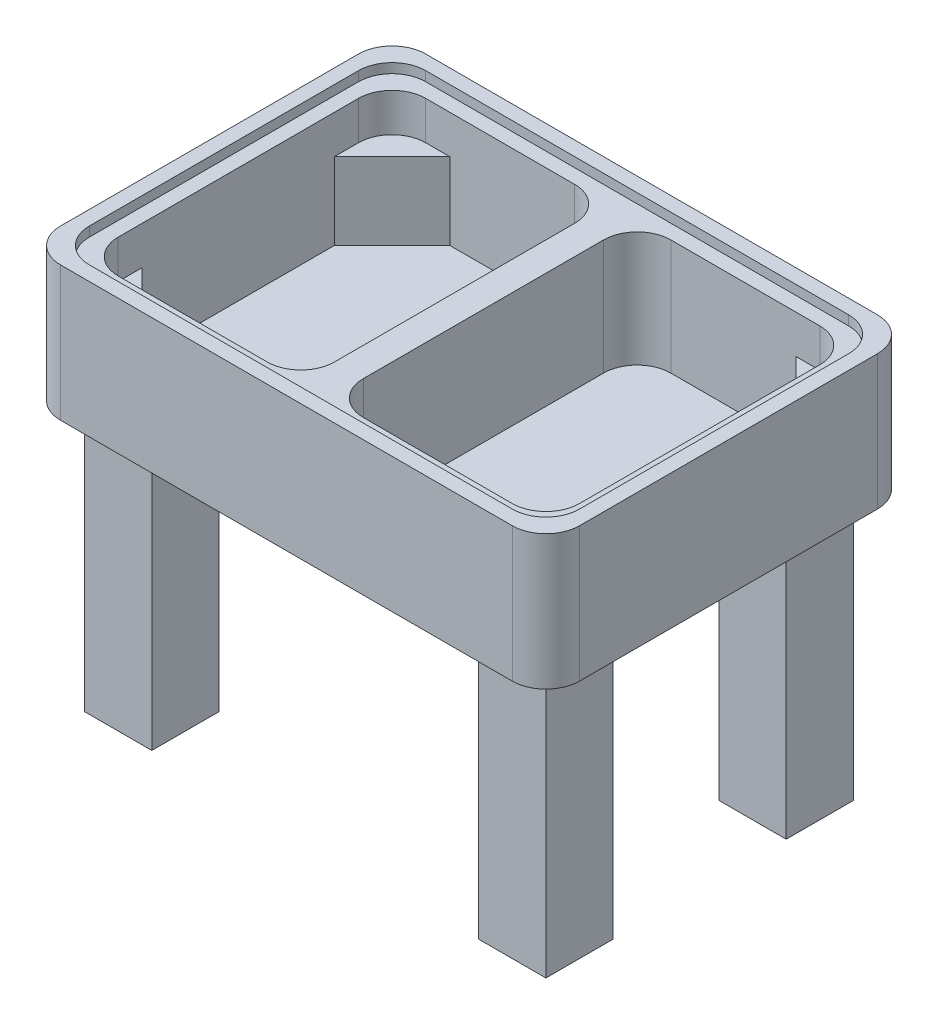
from build123d import *

# Parameters (mm, degrees)
SKETCH1_W           = 540
SKETCH1_H           = 380
BOSS_EXTRUDE1_DEPTH = 140
SKETCH3_W           = 510
SKETCH3_H           = 350
CUT_EXTRUDE1_DEPTH  = 10
SKETCH2_W           = 225
SKETCH2_H           = 320
CUT_EXTRUDE2_DEPTH  = 40
CUT_EXTRUDE3_DEPTH  = 80
FILLET1_R           = 35
SKETCH6_W           = 70
SKETCH6_H           = 70
BOSS_EXTRUDE2_DEPTH = 280


with BuildPart() as part:
    # Sketch1 → Boss-Extrude1 (new body)
    with BuildSketch(Plane(origin=(0, 0, 0), x_dir=(1, 0, 0), z_dir=(0, 1, 0))):
        with Locations((270, 190)):
            Rectangle(SKETCH1_W, SKETCH1_H)
    extrude(amount=-BOSS_EXTRUDE1_DEPTH)

    # Sketch3 → Cut-Extrude1 (cut)
    with BuildSketch(Plane(origin=(0, 0, 0), x_dir=(1, 0, 0), z_dir=(0, 1, 0))):
        with Locations((270, 190)):
            Rectangle(SKETCH3_W, SKETCH3_H)
    extrude(amount=-CUT_EXTRUDE1_DEPTH, mode=Mode.SUBTRACT)

    # Sketch2 → Cut-Extrude2 (cut)
    with BuildSketch(Plane(origin=(0, -10, 0), x_dir=(1, 0, 0), z_dir=(0, 1, 0))):
        with Locations((142.5, 190)):
            Rectangle(SKETCH2_W, SKETCH2_H)
        with Locations((397.5, 190)):
            Rectangle(SKETCH2_W, SKETCH2_H)
    extrude(amount=-CUT_EXTRUDE2_DEPTH, mode=Mode.SUBTRACT)

    # Sketch5 → Cut-Extrude3 (cut)
    with BuildSketch(Plane(origin=(0, -50, 0), x_dir=(1, 0, 0), z_dir=(0, 1, 0))):
        Polygon((30, 290), (90, 350), (255, 350), (255, 30), (90, 30), (30, 90), align=None)
        Polygon((510, 90), (450, 30), (285, 30), (285, 350), (450, 350), (510, 290), align=None)
    extrude(amount=-CUT_EXTRUDE3_DEPTH, mode=Mode.SUBTRACT)

    # Fillet1
    fillet1_edges = [part.edges().sort_by_distance(p)[0] for p in [
        (15, -5, -15),
        (15, -5, -365),
        (525, -5, -365),
        (525, -5, -15),
        (30, -30, -30),
        (30, -30, -350),
        (255, -70, -350),
        (255, -70, -30),
        (510, -30, -350),
        (510, -30, -30),
        (285, -70, -30),
        (285, -70, -350),
        (0, -70, -380),
        (540, -70, -380),
        (540, -70, 0),
        (0, -70, 0),
    ]]
    fillet(fillet1_edges, radius=FILLET1_R)

    # Sketch6 → Boss-Extrude2 (add)
    with BuildSketch(Plane.XZ.offset(140)):
        with Locations((65, -65)):
            Rectangle(SKETCH6_W, SKETCH6_H)
        with Locations((475, -65)):
            Rectangle(SKETCH6_W, SKETCH6_H)
        with Locations((475, -315)):
            Rectangle(SKETCH6_W, SKETCH6_H)
        with Locations((65, -315)):
            Rectangle(SKETCH6_W, SKETCH6_H)
    extrude(amount=BOSS_EXTRUDE2_DEPTH)


solid = part.part
